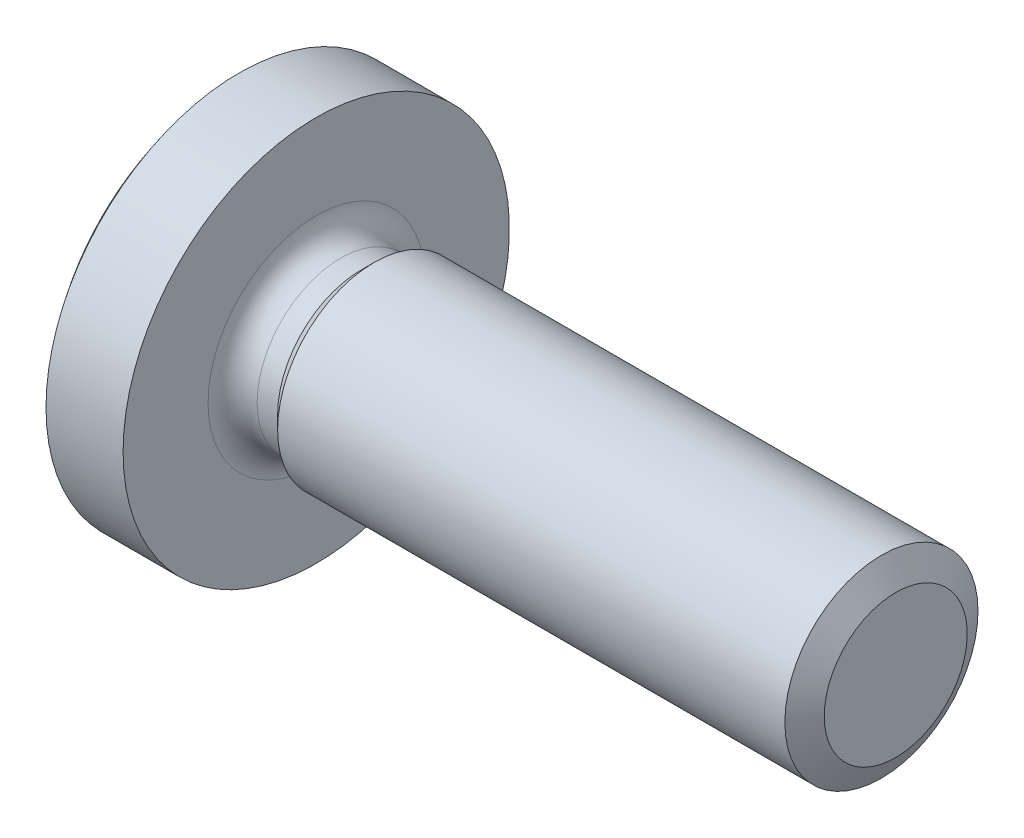
from build123d import *


with BuildPart() as part:
    # 草图2 → Revolve 709 (revolve)
    with BuildSketch(Plane.XY, mode=Mode.PRIVATE) as revolve_709_sk:
        with BuildLine():
            Line((0, 0), (37.5, 0))
            Line((37.5, 0), (37.5, 5))
            Line((37.5, 5), (10.5, 5))
            Line((10.5, 5), (9.83, 4.33))
            Line((9.83, 4.33), (8.77, 4.33))
            ThreePointArc((8.77, 4.33), (7.871974388, 4.701974388), (7.5, 5.6))
            Line((7.5, 5.6), (7.5, 10))
            Line((7.5, 10), (3.510004003, 10))
            ThreePointArc((3.510004003, 10), (0.902981487, 5.299059542), (0, 0))
        make_face()
    revolve(revolve_709_sk.sketch.rotate(Axis((-1.331757704, 0, 0), (1, 0, 0)), 90), axis=Axis((-1.331757704, 0, 0), (1, 0, 0)))

    # 草图3 → 切除-旋转1 (revolve, cut)
    with BuildSketch(Plane.XY, mode=Mode.PRIVATE) as cut_revolve_1_sk:
        Polygon((36.758124009, 5), (38.258124009, 5), (37.5, 3.701), align=None)
    revolve(cut_revolve_1_sk.sketch.rotate(Axis((-0.242766179, 0, 0), (1, 0, 0)), 90), axis=Axis((-0.242766179, 0, 0), (1, 0, 0)), mode=Mode.SUBTRACT)

    # 草图5 → 切除-放样1 section 0
    with BuildSketch(Plane(origin=(0, 0, 0), x_dir=(0, 0, -1), z_dir=(1, 0, 0)), mode=Mode.PRIVATE) as loft_1_s0:
        with BuildLine():
            Line((0.75, 5.05), (-0.75, 5.05))
            Line((-0.75, 5.05), (-0.75, -5.05))
            Line((-0.75, -5.05), (0.75, -5.05))
            Line((0.75, -5.05), (0.75, 5.05))
        make_face()
    loft_1 = loft([Vertex(5.8, 0, 0), loft_1_s0.sketch], mode=Mode.SUBTRACT)

    # 镜向1: 切除-放样1 across plane
    add(loft_1.mirror(Plane(origin=(0, 0, 0), x_dir=(0, 0.7071067811865462, 0.7071067811865488), z_dir=(0, -0.7071067811865488, 0.7071067811865462))), mode=Mode.SUBTRACT)


solid = part.part
